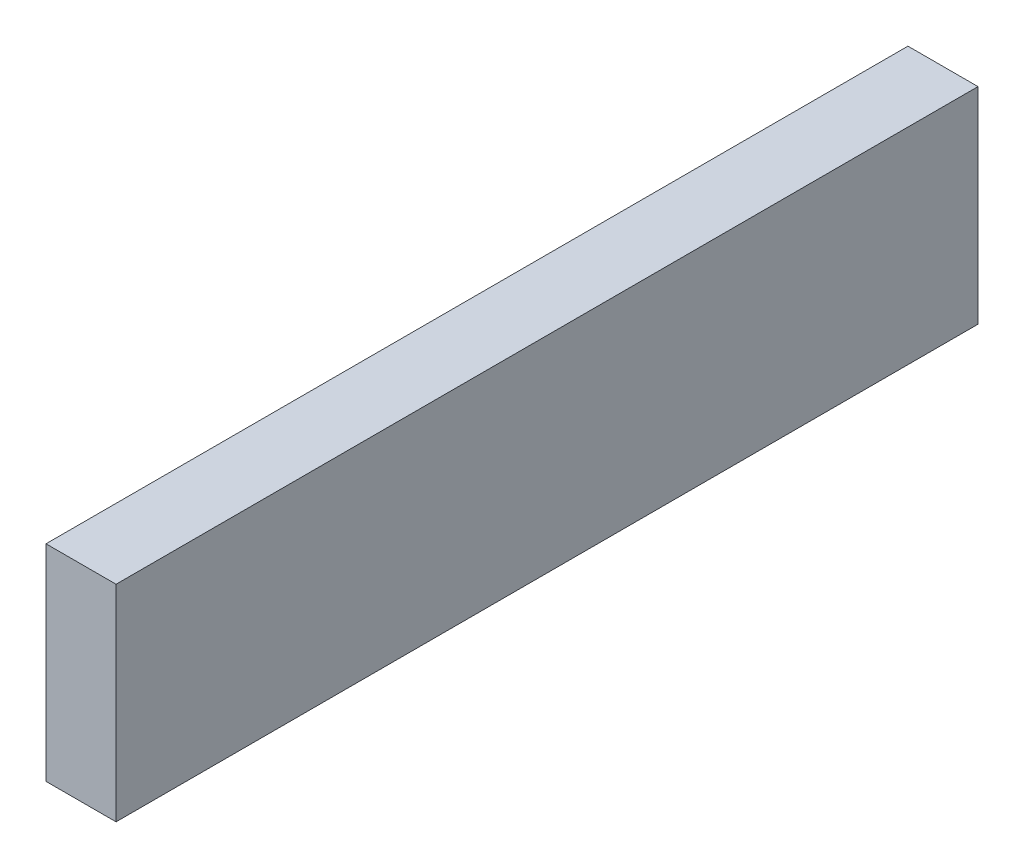
from build123d import *

# Parameters (mm, degrees)
SKETCH1_W           = 20.32
SKETCH1_H           = 59.69
BOSS_EXTRUDE1_DEPTH = 250


with BuildPart() as part:
    # Sketch1 → Boss-Extrude1 (new body)
    with BuildSketch(Plane.XY):
        Rectangle(SKETCH1_W, SKETCH1_H)
    extrude(amount=BOSS_EXTRUDE1_DEPTH)


solid = part.part
